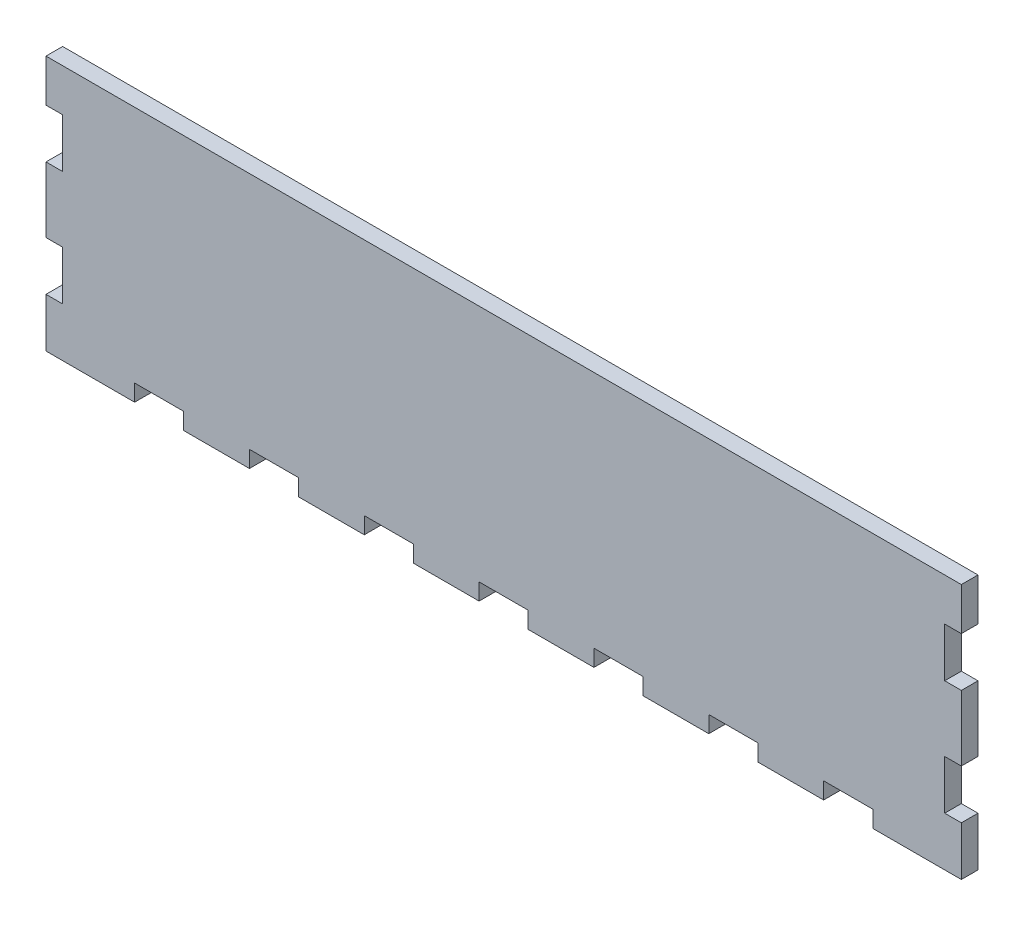
from build123d import *

# Parameters (mm, degrees)
BOSS_EXTRUDE1_DEPTH = 5.08


with BuildPart() as part:
    # Sketch27 → Boss-Extrude1 (new body)
    with BuildSketch(Plane.XY):
        Polygon((-5.201580342, -266.360351909), (21.842390942, -266.360140559), (21.842390942, -261.280140559), (36.842390942, -261.280140559), (36.842390942, -266.360140559), (56.894390942, -266.360140559), (56.894390942, -261.280140559), (71.894390942, -261.280140559), (71.894390942, -266.360140559), (91.946390942, -266.360140559), (91.946390942, -261.280140559), (106.946390942, -261.280140559), (106.946390942, -266.360140559), (126.998390942, -266.360351909), (126.998390942, -261.280140559), (141.998390942, -261.280140559), (141.998390942, -266.360351909), (162.050390942, -266.360351909), (162.050390942, -261.280140559), (177.050390942, -261.280140559), (177.050390942, -266.360351909), (197.102390942, -266.360140559), (197.102390942, -261.280140559), (212.102390942, -261.280140559), (212.102390942, -266.360140559), (232.154390942, -266.360140559), (232.154390942, -261.280140559), (247.154390942, -261.280140559), (247.154390942, -266.360140559), (274.198419658, -266.360351909), (274.198419658, -251.360339496), (269.118419658, -251.360339496), (269.118419658, -236.360339496), (274.198419658, -236.360339496), (274.198419658, -216.360339496), (269.118419658, -216.360339496), (269.118419658, -201.360339496), (274.198419658, -201.360339496), (274.198419658, -188.380351909), (-5.201580342, -188.380351909), (-5.201580342, -201.360351909), (-0.121580342, -201.360351909), (-0.121580342, -216.360351909), (-5.201580342, -216.360351909), (-5.201580342, -236.360351909), (-0.121580342, -236.360351909), (-0.121580342, -251.360351909), (-5.201580342, -251.360351909), align=None)
    extrude(amount=BOSS_EXTRUDE1_DEPTH)


solid = part.part
